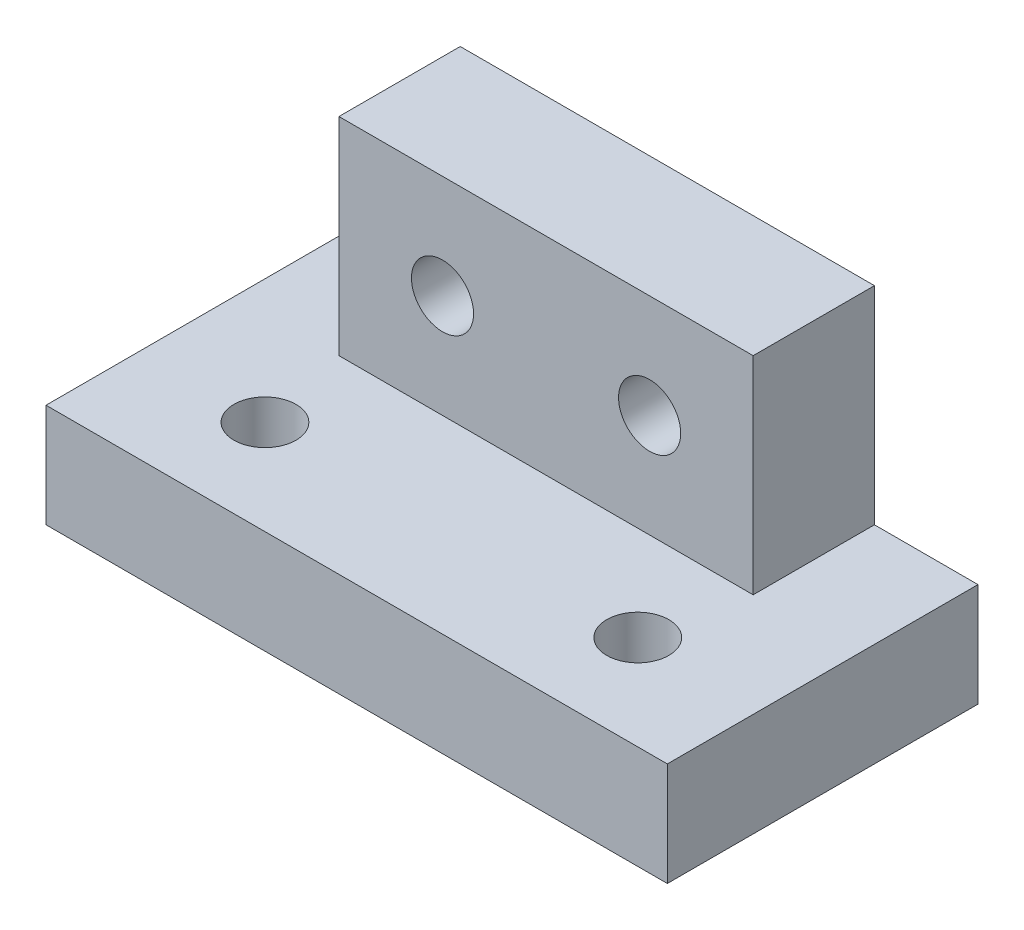
from build123d import *

# Parameters (mm, degrees)
SKETCH_1_W          = 30
SKETCH_1_H          = 15
EXTRUDE_1_DEPTH     = 5
SKETCH_2_W          = 10
SKETCH_2_H          = 5.85548899
EXTRUDE_3_DEPTH     = 10
SKETCH_4_R          = 1.5
CUT_EXTRUDE_1_DEPTH = 6
SKETCH_5_R          = 1.5
CUT_EXTRUDE_2_DEPTH = 5


with BuildPart() as part:
    # Эскиз1 → Бобышка-Вытянуть1 (new body)
    with BuildSketch(Plane(origin=(0, 0, 0), x_dir=(1, 0, 0), z_dir=(0, 1, 0))):
        with Locations((-25.518864851, -20.257046334)):
            Rectangle(SKETCH_1_W, SKETCH_1_H)
    extrude(amount=EXTRUDE_1_DEPTH)

    # Эскиз2 → Бобышка-Вытянуть3 (add)
    with BuildSketch(Plane(origin=(0, 5, 0), x_dir=(1, 0, 0), z_dir=(0, 1, 0))):
        with Locations((-20.518864851, -15.684790829)):
            Rectangle(SKETCH_2_W, SKETCH_2_H)
        with Locations((-30.518864851, -15.684790829)):
            Rectangle(SKETCH_2_W, SKETCH_2_H)
    extrude(amount=EXTRUDE_3_DEPTH)

    # Эскиз4 → Вырез-Вытянуть1 (cut)
    with BuildSketch(Plane.XY.offset(18.612535324)):
        with Locations((-20.518864851, 10)):
            Circle(SKETCH_4_R)
        with Locations((-30.518864851, 10)):
            Circle(SKETCH_4_R)
    extrude(amount=-CUT_EXTRUDE_1_DEPTH, mode=Mode.SUBTRACT)

    # Эскиз5 → Вырез-Вытянуть2 (cut)
    with BuildSketch(Plane(origin=(0, 5, 0), x_dir=(1, 0, 0), z_dir=(0, 1, 0))):
        with Locations(Location((-34.518864851, -23.184790829, 0), (0, 0, 270))):
            Circle(SKETCH_5_R)
        with Locations(Location((-16.518864851, -23.184790829, 0), (0, 0, 270))):
            Circle(SKETCH_5_R)
    extrude(amount=-CUT_EXTRUDE_2_DEPTH, mode=Mode.SUBTRACT)


solid = part.part
